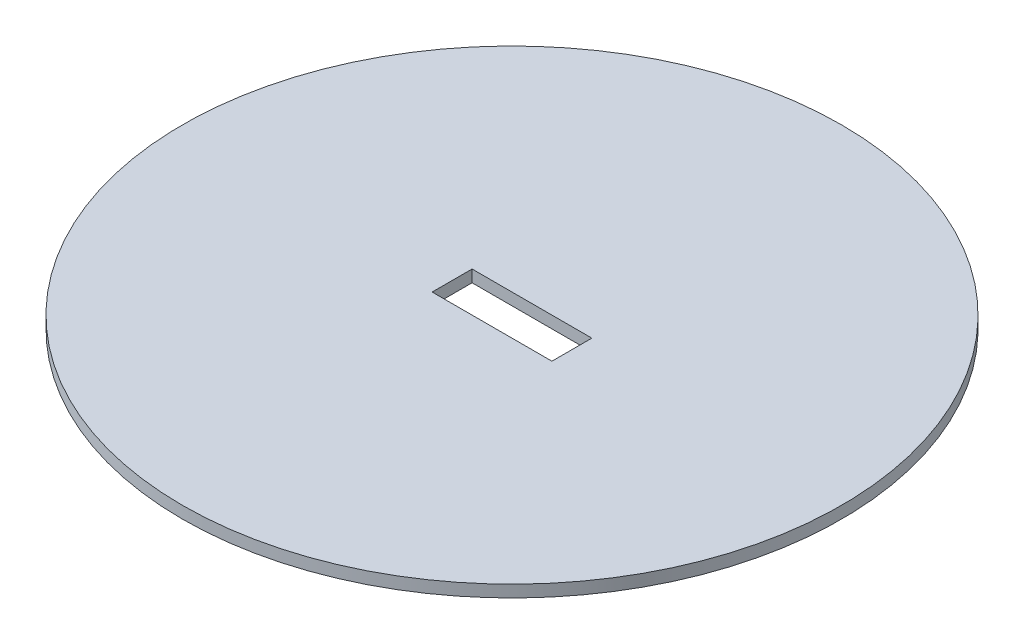
from build123d import *

# Parameters (mm, degrees)
SKETCH1_R           = 82.55
BOSS_EXTRUDE1_DEPTH = 3
SKETCH2_W           = 30
SKETCH2_H           = 10
CUT_EXTRUDE1_DEPTH  = 13


with BuildPart() as part:
    # Sketch1 → Boss-Extrude1 (new body)
    with BuildSketch(Plane(origin=(0, 0, 0), x_dir=(1, 0, 0), z_dir=(0, 1, 0))):
        with Locations(Location((0, 0, 0), (0, 0, 270))):
            Circle(SKETCH1_R)
    extrude(amount=BOSS_EXTRUDE1_DEPTH)

    # Sketch2 → Cut-Extrude1 (cut)
    with BuildSketch(Plane(origin=(0, 3, 0), x_dir=(1, 0, 0), z_dir=(0, 1, 0))):
        Rectangle(SKETCH2_W, SKETCH2_H)
    extrude(amount=-CUT_EXTRUDE1_DEPTH, mode=Mode.SUBTRACT)


solid = part.part
